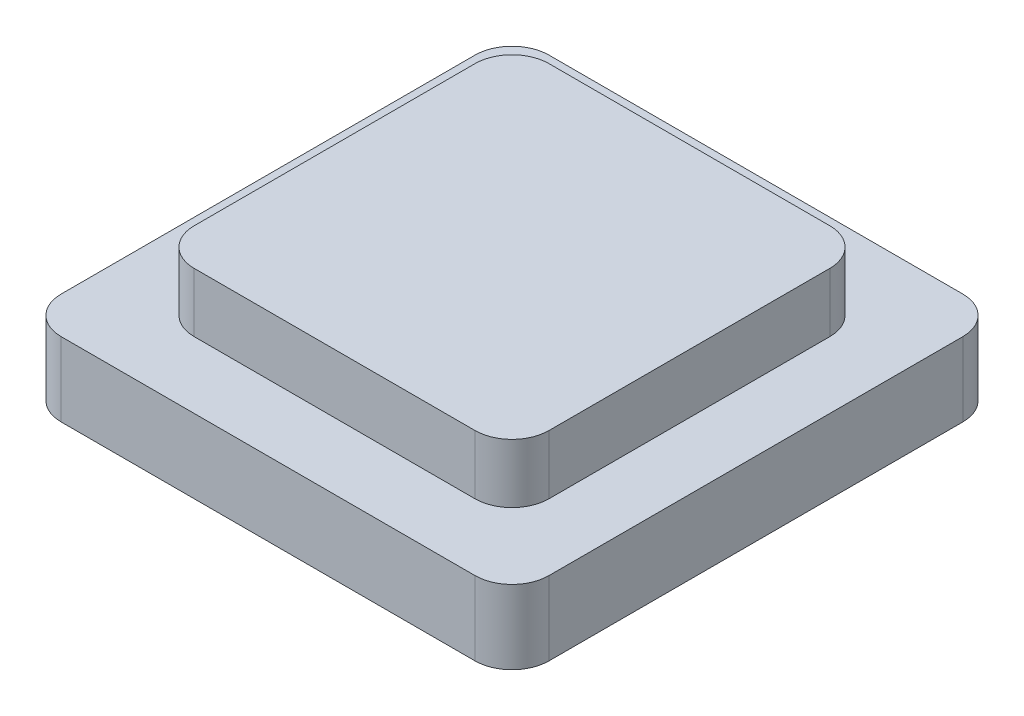
from build123d import *

# Parameters (mm, degrees)
EXTRUDE_1_DEPTH     = 1.6
EXTRUDE_2_DEPTH     = 2
CUT_EXTRUDE_1_DEPTH = 3.1
CUT_EXTRUDE_2_DEPTH = 1


with BuildPart() as part:
    # 草图1 → 凸台-拉伸1 (new body)
    with BuildSketch(Plane(origin=(0, 0, 0), x_dir=(1, 0, 0), z_dir=(0, 1, 0))):
        with BuildLine():
            Line((-3.8, 4.8), (3.8, 4.8))
            ThreePointArc((3.8, 4.8), (4.507106781, 4.507106781), (4.8, 3.8))
            Line((4.8, 3.8), (4.8, -3.8))
            ThreePointArc((4.8, -3.8), (4.507106781, -4.507106781), (3.8, -4.8))
            Line((3.8, -4.8), (-3.8, -4.8))
            ThreePointArc((-3.8, -4.8), (-4.507106781, -4.507106781), (-4.8, -3.8))
            Line((-4.8, -3.8), (-4.8, 3.8))
            ThreePointArc((-4.8, 3.8), (-4.507106781, 4.507106781), (-3.8, 4.8))
        make_face()
    extrude(amount=EXTRUDE_1_DEPTH)

    # 草图2 → 凸台-拉伸2 (add)
    with BuildSketch(Plane.XZ):
        with BuildLine():
            Line((-5.6, 6.6), (5.6, 6.6))
            ThreePointArc((5.6, 6.6), (6.307106781, 6.307106781), (6.6, 5.6))
            Line((6.6, 5.6), (6.6, -5.6))
            ThreePointArc((6.6, -5.6), (6.307106781, -6.307106781), (5.6, -6.6))
            Line((5.6, -6.6), (-5.6, -6.6))
            ThreePointArc((-5.6, -6.6), (-6.307106781, -6.307106781), (-6.6, -5.6))
            Line((-6.6, -5.6), (-6.6, 5.6))
            ThreePointArc((-6.6, 5.6), (-6.307106781, 6.307106781), (-5.6, 6.6))
        make_face()
    extrude(amount=EXTRUDE_2_DEPTH)

    # 草图3 → 切除-拉伸1 (cut)
    with BuildSketch(Plane.XZ.offset(2)):
        with BuildLine():
            Line((-3.3, -4.3), (3.3, -4.3))
            ThreePointArc((3.3, -4.3), (4.007106781, -4.007106781), (4.3, -3.3))
            Line((4.3, -3.3), (4.3, 3.3))
            ThreePointArc((4.3, 3.3), (4.007106781, 4.007106781), (3.3, 4.3))
            Line((3.3, 4.3), (-3.3, 4.3))
            ThreePointArc((-3.3, 4.3), (-4.007106781, 4.007106781), (-4.3, 3.3))
            Line((-4.3, 3.3), (-4.3, -3.3))
            ThreePointArc((-4.3, -3.3), (-4.007106781, -4.007106781), (-3.3, -4.3))
        make_face()
    extrude(amount=-CUT_EXTRUDE_1_DEPTH, mode=Mode.SUBTRACT)

    # 草图4 → 切除-拉伸2 (cut)
    with BuildSketch(Plane.XZ.offset(2)):
        with BuildLine():
            Line((-4.6, 5.6), (4.6, 5.6))
            ThreePointArc((4.6, 5.6), (5.307106781, 5.307106781), (5.6, 4.6))
            Line((5.6, 4.6), (5.6, -4.6))
            ThreePointArc((5.6, -4.6), (5.307106781, -5.307106781), (4.6, -5.6))
            Line((4.6, -5.6), (-4.6, -5.6))
            ThreePointArc((-4.6, -5.6), (-5.307106781, -5.307106781), (-5.6, -4.6))
            Line((-5.6, -4.6), (-5.6, 4.6))
            ThreePointArc((-5.6, 4.6), (-5.307106781, 5.307106781), (-4.6, 5.6))
        make_face()
    extrude(amount=-CUT_EXTRUDE_2_DEPTH, mode=Mode.SUBTRACT)


solid = part.part
